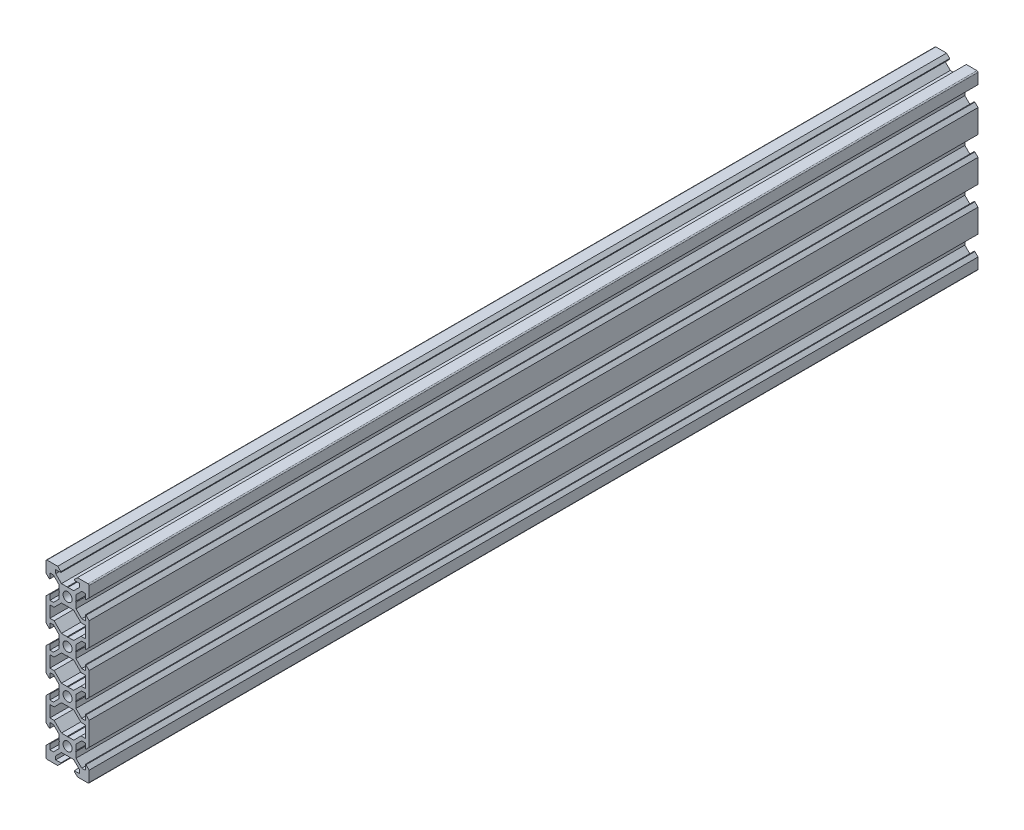
from build123d import *

# Parameters (mm, degrees)
BOSS_EXTRU_1_DEPTH = 412


with BuildPart() as part:
    # Esquisse1 → Boss.-Extru.1 (new body)
    with BuildSketch(Plane.XY):
        with BuildLine():
            Line((-9.5, 10), (-4.58, 10))
            Line((-4.58, 10), (-3.125, 8.545))
            Line((-3.125, 8.545), (-3.125, 8.2))
            Line((-3.125, 8.2), (-5.5, 8.2))
            Line((-5.5, 8.2), (-5.5, 6.560660172))
            Line((-5.5, 6.560660172), (-2.839339828, 3.9))
            Line((-2.839339828, 3.9), (-0.21, 3.9))
            Line((-0.21, 3.9), (0, 3.69))
            Line((0, 3.69), (0, 2.1))
            ThreePointArc((0, 2.1), (-2.1, 0), (0, -2.1))
            Line((0, -2.1), (0, -3.69))
            Line((0, -3.69), (-0.21, -3.9))
            Line((-0.21, -3.9), (-2.839339828, -3.9))
            Line((-2.839339828, -3.9), (-6.239339828, -7.3))
            Line((-6.239339828, -7.3), (-8.2, -7.3))
            Line((-8.2, -7.3), (-8.2, -12.7))
            Line((-8.2, -12.7), (-6.239339828, -12.7))
            Line((-6.239339828, -12.7), (-2.839339828, -16.1))
            Line((-2.839339828, -16.1), (-0.21, -16.1))
            Line((-0.21, -16.1), (0, -16.31))
            Line((0, -16.31), (0, -17.9))
            ThreePointArc((0, -17.9), (-2.1, -20), (0, -22.1))
            Line((0, -22.1), (0, -23.69))
            Line((0, -23.69), (-0.21, -23.9))
            Line((-0.21, -23.9), (-2.839339828, -23.9))
            Line((-2.839339828, -23.9), (-6.239339828, -27.3))
            Line((-6.239339828, -27.3), (-8.2, -27.3))
            Line((-8.2, -27.3), (-8.2, -32.7))
            Line((-8.2, -32.7), (-6.239339828, -32.7))
            Line((-6.239339828, -32.7), (-2.839339828, -36.1))
            Line((-2.839339828, -36.1), (-0.21, -36.1))
            Line((-0.21, -36.1), (0, -36.31))
            Line((0, -36.31), (0, -37.9))
            ThreePointArc((0, -37.9), (-2.1, -40), (0, -42.1))
            Line((0, -42.1), (0, -43.69))
            Line((0, -43.69), (-0.21, -43.9))
            Line((-0.21, -43.9), (-2.839339828, -43.9))
            Line((-2.839339828, -43.9), (-6.239339828, -47.3))
            Line((-6.239339828, -47.3), (-8.2, -47.3))
            Line((-8.2, -47.3), (-8.2, -52.7))
            Line((-8.2, -52.7), (-6.239339828, -52.7))
            Line((-6.239339828, -52.7), (-2.839339828, -56.1))
            Line((-2.839339828, -56.1), (-0.21, -56.1))
            Line((-0.21, -56.1), (0, -56.31))
            Line((0, -56.31), (0, -57.9))
            ThreePointArc((0, -57.9), (-2.1, -60), (0, -62.1))
            Line((0, -62.1), (0, -63.69))
            Line((0, -63.69), (-0.21, -63.9))
            Line((-0.21, -63.9), (-2.839339828, -63.9))
            Line((-2.839339828, -63.9), (-5.5, -66.560660172))
            Line((-5.5, -66.560660172), (-5.5, -68.2))
            Line((-5.5, -68.2), (-3.125, -68.2))
            Line((-3.125, -68.2), (-3.125, -68.545))
            Line((-3.125, -68.545), (-4.58, -70))
            Line((-4.58, -70), (-9.5, -70))
            ThreePointArc((-9.5, -70), (-9.853553391, -69.853553391), (-10, -69.5))
            Line((-10, -69.5), (-10, -64.58))
            Line((-10, -64.58), (-8.545, -63.125))
            Line((-8.545, -63.125), (-8.2, -63.125))
            Line((-8.2, -63.125), (-8.2, -65.5))
            Line((-8.2, -65.5), (-6.560660172, -65.5))
            Line((-6.560660172, -65.5), (-3.9, -62.839339828))
            Line((-3.9, -62.839339828), (-3.9, -60.21))
            Line((-3.9, -60.21), (-3.69, -60))
            Line((-3.69, -60), (-3.9, -59.79))
            Line((-3.9, -59.79), (-3.9, -57.160660172))
            Line((-3.9, -57.160660172), (-6.560660172, -54.5))
            Line((-6.560660172, -54.5), (-8.2, -54.5))
            Line((-8.2, -54.5), (-8.2, -56.875))
            Line((-8.2, -56.875), (-8.545, -56.875))
            Line((-8.545, -56.875), (-10, -55.42))
            Line((-10, -55.42), (-10, -44.58))
            Line((-10, -44.58), (-8.545, -43.125))
            Line((-8.545, -43.125), (-8.2, -43.125))
            Line((-8.2, -43.125), (-8.2, -45.5))
            Line((-8.2, -45.5), (-6.560660172, -45.5))
            Line((-6.560660172, -45.5), (-3.9, -42.839339828))
            Line((-3.9, -42.839339828), (-3.9, -40.21))
            Line((-3.9, -40.21), (-3.69, -40))
            Line((-3.69, -40), (-3.9, -39.79))
            Line((-3.9, -39.79), (-3.9, -37.160660172))
            Line((-3.9, -37.160660172), (-6.560660172, -34.5))
            Line((-6.560660172, -34.5), (-8.2, -34.5))
            Line((-8.2, -34.5), (-8.2, -36.875))
            Line((-8.2, -36.875), (-8.545, -36.875))
            Line((-8.545, -36.875), (-10, -35.42))
            Line((-10, -35.42), (-10, -24.58))
            Line((-10, -24.58), (-8.545, -23.125))
            Line((-8.545, -23.125), (-8.2, -23.125))
            Line((-8.2, -23.125), (-8.2, -25.5))
            Line((-8.2, -25.5), (-6.560660172, -25.5))
            Line((-6.560660172, -25.5), (-3.9, -22.839339828))
            Line((-3.9, -22.839339828), (-3.9, -20.21))
            Line((-3.9, -20.21), (-3.69, -20))
            Line((-3.69, -20), (-3.9, -19.79))
            Line((-3.9, -19.79), (-3.9, -17.160660172))
            Line((-3.9, -17.160660172), (-6.560660172, -14.5))
            Line((-6.560660172, -14.5), (-8.2, -14.5))
            Line((-8.2, -14.5), (-8.2, -16.875))
            Line((-8.2, -16.875), (-8.545, -16.875))
            Line((-8.545, -16.875), (-10, -15.42))
            Line((-10, -15.42), (-10, -4.58))
            Line((-10, -4.58), (-8.545, -3.125))
            Line((-8.545, -3.125), (-8.2, -3.125))
            Line((-8.2, -3.125), (-8.2, -5.5))
            Line((-8.2, -5.5), (-6.560660172, -5.5))
            Line((-6.560660172, -5.5), (-3.9, -2.839339828))
            Line((-3.9, -2.839339828), (-3.9, -0.21))
            Line((-3.9, -0.21), (-3.69, 0))
            Line((-3.69, 0), (-3.9, 0.21))
            Line((-3.9, 0.21), (-3.9, 2.839339828))
            Line((-3.9, 2.839339828), (-6.560660172, 5.5))
            Line((-6.560660172, 5.5), (-8.2, 5.5))
            Line((-8.2, 5.5), (-8.2, 3.125))
            Line((-8.2, 3.125), (-8.545, 3.125))
            Line((-8.545, 3.125), (-10, 4.58))
            Line((-10, 4.58), (-10, 9.5))
            ThreePointArc((-10, 9.5), (-9.853553391, 9.853553391), (-9.5, 10))
        make_face()
    boss_extru_1 = extrude(amount=BOSS_EXTRU_1_DEPTH)

    # Symétrie1: Boss.-Extru.1 across plane
    add(boss_extru_1.mirror(Plane(origin=(0, 3.69, 412), x_dir=(0, 0, 1), z_dir=(-1, 0, 0))))


solid = part.part
